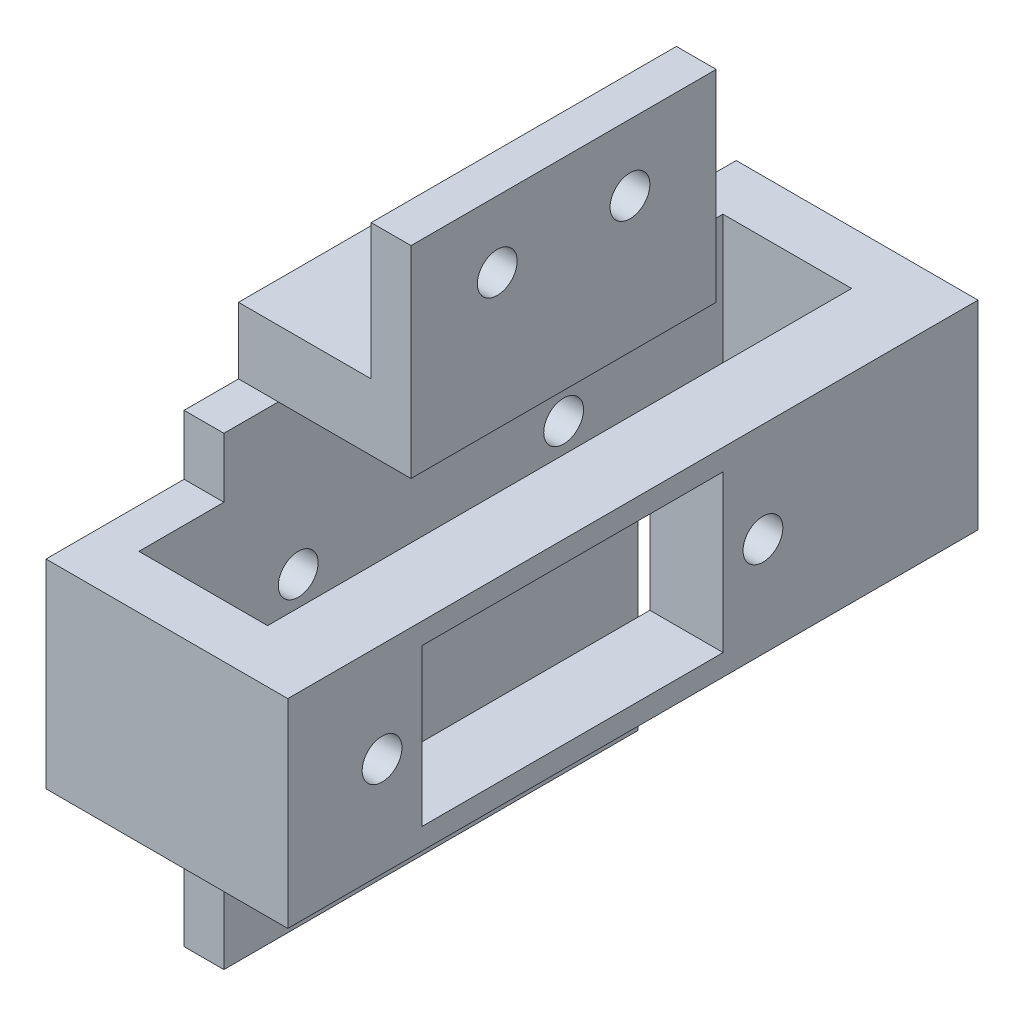
from build123d import *

# Parameters (mm, degrees)
ESQUISSE1_W             = 23
ESQUISSE1_H             = 15.2
ESQUISSE1_R             = 1.5
BOSS_EXTRU_1_DEPTH      = 3
ESQUISSE2_W             = 23
ESQUISSE2_H             = 5
BOSS_EXTRU_2_DEPTH      = 10
ESQUISSE4_W             = 3
ESQUISSE4_H             = 31.2
BOSS_EXTRU_3_DEPTH      = 35
CONG_1_R                = 10
ESQUISSE7_W             = 10.405823793
ESQUISSE7_H             = 15
BOSS_EXTRU_4_DEPTH      = 3
ESQUISSE8_W             = 4
ESQUISSE8_H             = 15
BOSS_EXTRU_5_DEPTH      = 9.7
ESQUISSE9_W             = 26.005823793
ESQUISSE9_H             = 15
BOSS_EXTRU_6_DEPTH      = 5.52
ESQUISSE10_R            = 1.5
ENL_V_MAT_EXTRU_2_DEPTH = 5.52
ESQUISSE5_R             = 1.5
ENL_V_MAT_EXTRU_3_DEPTH = 10


with BuildPart() as part:
    # Esquisse1 → Boss.-Extru.1 (new body)
    with BuildSketch(Plane(origin=(0, 0, 0), x_dir=(0, 0, -1), z_dir=(1, 0, 0))):
        with Locations((11.5, -7.6)):
            Rectangle(ESQUISSE1_W, ESQUISSE1_H)
        with Locations((6.5, -5)):
            Circle(ESQUISSE1_R, mode=Mode.SUBTRACT)
        with Locations(Location((16.5, -5, 0), (0, 0, 180))):
            Circle(ESQUISSE1_R, mode=Mode.SUBTRACT)
    extrude(amount=BOSS_EXTRU_1_DEPTH)

    # Esquisse2 → Boss.-Extru.2 (add)
    with BuildSketch(Plane.ZY):
        with Locations((-11.5, -12.7)):
            Rectangle(ESQUISSE2_W, ESQUISSE2_H)
    boss_extru_2 = extrude(amount=BOSS_EXTRU_2_DEPTH)

    # Esquisse4 → Boss.-Extru.3 (add)
    with BuildSketch(Plane.XZ.offset(15.2)):
        with Locations((-8.5, -11.5)):
            Rectangle(ESQUISSE4_W, ESQUISSE4_H)
    boss_extru_3 = extrude(amount=BOSS_EXTRU_3_DEPTH)

    # Congé1
    cong_1_edges = [part.edges().sort_by_distance(p)[0] for p in [
        (-8.5, -50.2, -27.1),
        (-8.5, -50.2, 4.1),
    ]]
    fillet(cong_1_edges, radius=CONG_1_R)

    # Esquisse7 → Boss.-Extru.4 (add, through all)
    with BuildSketch(Plane(origin=(-7, 0, 0), x_dir=(0, 0, -1), z_dir=(1, 0, 0))):
        with Locations((-9.302911897, -27.2)):
            Rectangle(ESQUISSE7_W, ESQUISSE7_H)
    boss_extru_4 = extrude(amount=-BOSS_EXTRU_4_DEPTH)

    # Esquisse8 → Boss.-Extru.5 (add)
    with BuildSketch(Plane(origin=(-7, 0, 0), x_dir=(0, 0, -1), z_dir=(1, 0, 0))):
        with Locations((-12.505823793, -27.2)):
            Rectangle(ESQUISSE8_W, ESQUISSE8_H)
    boss_extru_5 = extrude(amount=BOSS_EXTRU_5_DEPTH)

    # Esquisse9 → Boss.-Extru.6 (add)
    with BuildSketch(Plane(origin=(2.7, 0, 0), x_dir=(0, 0, -1), z_dir=(1, 0, 0))):
        with Locations((-1.502911897, -27.2)):
            Rectangle(ESQUISSE9_W, ESQUISSE9_H)
    boss_extru_6 = extrude(amount=BOSS_EXTRU_6_DEPTH)

    # Symétrie1: Boss.-Extru.2, Boss.-Extru.3, Boss.-Extru.4, Boss.-Extru.5, Boss.-Extru.6 across plane
    add(boss_extru_2.mirror(Plane(origin=(8.22, -19.7, -11.5), x_dir=(1, 0, 0), z_dir=(0, 0, 1))))
    add(boss_extru_3.mirror(Plane(origin=(8.22, -19.7, -11.5), x_dir=(1, 0, 0), z_dir=(0, 0, 1))))
    add(boss_extru_4.mirror(Plane(origin=(8.22, -19.7, -11.5), x_dir=(1, 0, 0), z_dir=(0, 0, 1))))
    add(boss_extru_5.mirror(Plane(origin=(8.22, -19.7, -11.5), x_dir=(1, 0, 0), z_dir=(0, 0, 1))))
    add(boss_extru_6.mirror(Plane(origin=(8.22, -19.7, -11.5), x_dir=(1, 0, 0), z_dir=(0, 0, 1))))

    # Esquisse10 → Enlèv. mat.-Extru.2 (cut)
    with BuildSketch(Plane(origin=(8.22, 0, 0), x_dir=(0, 0, -1), z_dir=(1, 0, 0))):
        with BuildLine():
            ThreePointArc((3, -27.2), (1.5, -25.7), (0, -27.2))
            Line((0, -27.2), (3, -27.2))
        make_face()
        with BuildLine():
            Line((3, -27.2), (0, -27.2))
            ThreePointArc((0, -27.2), (1.5, -28.7), (3, -27.2))
        make_face()
        with BuildLine():
            Line((-4.4, -21.3), (-4.4, -27.2))
            Line((-4.4, -27.2), (0, -27.2))
            ThreePointArc((0, -27.2), (1.5, -25.7), (3, -27.2))
            Line((3, -27.2), (18.3, -27.2))
            Line((18.3, -27.2), (18.3, -21.3))
            Line((18.3, -21.3), (-4.4, -21.3))
        make_face()
        with BuildLine():
            Line((0, -27.2), (-4.4, -27.2))
            Line((-4.4, -27.2), (-4.4, -33.1))
            Line((-4.4, -33.1), (18.3, -33.1))
            Line((18.3, -33.1), (18.3, -27.2))
            Line((18.3, -27.2), (3, -27.2))
            ThreePointArc((3, -27.2), (1.5, -28.7), (0, -27.2))
        make_face()
        with Locations((-7.4, -27.2)):
            Circle(ESQUISSE10_R)
        with Locations((21.3, -27.2)):
            Circle(ESQUISSE10_R)
    extrude(amount=-ENL_V_MAT_EXTRU_2_DEPTH, mode=Mode.SUBTRACT)

    # Esquisse5 → Enlèv. mat.-Extru.3 (cut)
    with BuildSketch(Plane(origin=(-7, 0, 0), x_dir=(0, 0, -1), z_dir=(1, 0, 0))):
        with Locations((6.5, -45.2)):
            Circle(ESQUISSE5_R)
        with Locations((1.5, -27.2)):
            Circle(ESQUISSE5_R)
        with Locations((16.5, -45.2)):
            Circle(ESQUISSE5_R)
        with Locations((21.5, -27.2)):
            Circle(ESQUISSE5_R)
    extrude(amount=-ENL_V_MAT_EXTRU_3_DEPTH, mode=Mode.SUBTRACT)


solid = part.part
